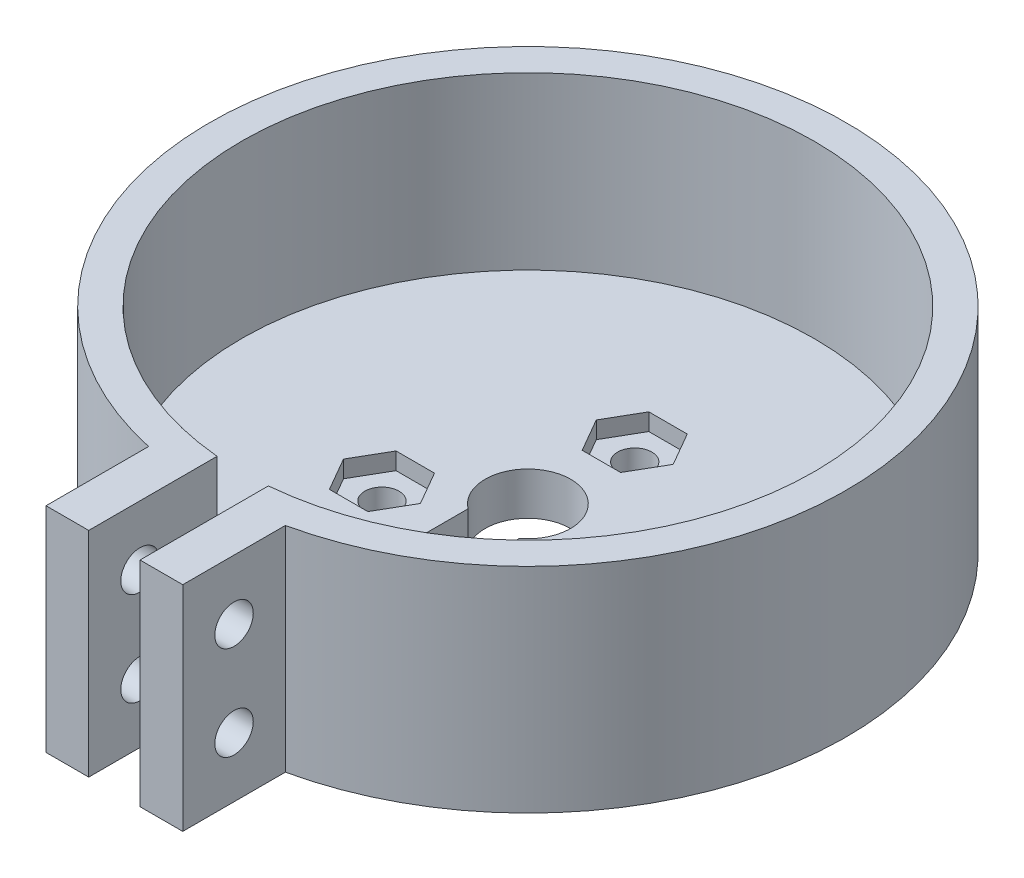
from build123d import *

# Parameters (mm, degrees)
SKETCH_1_R            = 37.25
SKETCH_1_R_2          = 33.5
MAIN_DEPTH            = 25
SKETCH_3_R            = 33.5
SKETCH_3_R_2          = 5
STOP_DEPTH            = 5
LOCK_DEPTH            = 25
SKETCH_5_W            = 6
SKETCH_5_H            = 48.380798507
SLOT_DEPTH            = 25
SKETCH_6_R            = 2.25
SMALL_HOLES_DEPTH     = 71.804407802
HOLES_FOR_BOLTS_REACH = 66.252
SKETCH_7_R            = 2
HEXAGONS_DEPTH        = 2


with BuildPart() as part:
    # Эскиз1 → main (new body)
    with BuildSketch(Plane(origin=(0, 0, 0), x_dir=(1, 0, 0), z_dir=(0, 1, 0))):
        with Locations(Location((0, 0, 0), (0, 0, 90))):
            Circle(SKETCH_1_R)
        with Locations(Location((0, 0, 0), (0, 0, 270))):
            Circle(SKETCH_1_R_2, mode=Mode.SUBTRACT)
    extrude(amount=MAIN_DEPTH)

    # Эскиз3 → stop (add)
    with BuildSketch(Plane(origin=(0, 0, 0), x_dir=(1, 0, 0), z_dir=(0, 1, 0))):
        with Locations(Location((0, 0, 0), (0, 0, 270))):
            Circle(SKETCH_3_R)
        with Locations(Location((0, 0, 0), (0, 0, 270))):
            Circle(SKETCH_3_R_2, mode=Mode.SUBTRACT)
    extrude(amount=STOP_DEPTH)

    # Эскиз4 → lock (add)
    with BuildSketch(Plane(origin=(0, 0, 0), x_dir=(1, 0, 0), z_dir=(0, 1, 0))):
        with BuildLine():
            Line((-8, -36.380798507), (-8, -48.380798507))
            Line((-8, -48.380798507), (8, -48.380798507))
            Line((8, -48.380798507), (8, -36.380798507))
            ThreePointArc((8, -36.380798507), (0, -37.25), (-8, -36.380798507))
        make_face()
    extrude(amount=LOCK_DEPTH)

    # Эскиз5 → slot (cut)
    with BuildSketch(Plane(origin=(0, 0, 0), x_dir=(1, 0, 0), z_dir=(0, 1, 0))):
        with Locations((0, -24.190399254)):
            Rectangle(SKETCH_5_W, SKETCH_5_H)
    extrude(amount=SLOT_DEPTH, mode=Mode.SUBTRACT)

    # Эскиз6 → small holes (cut, through all)
    with BuildSketch(Plane(origin=(8, 0, 0), x_dir=(0, 0, -1), z_dir=(1, 0, 0))):
        with Locations((-42.380798507, 7)):
            Circle(SKETCH_6_R)
        with Locations((-42.380798507, 18)):
            Circle(SKETCH_6_R)
    extrude(amount=-SMALL_HOLES_DEPTH, mode=Mode.SUBTRACT)

    # Эскиз7 → holes for bolts (cut, up to next)
    with BuildSketch(Plane(origin=(0, 5, 0), x_dir=(1, 0, 0), z_dir=(0, 1, 0)), mode=Mode.PRIVATE) as holes_for_bolts_sk1:
        with Locations(Location((0, 12.5, 0), (0, 0, 270))):
            Circle(SKETCH_7_R)
    holes_for_bolts_tool1 = extrude(holes_for_bolts_sk1.sketch, amount=-HOLES_FOR_BOLTS_REACH, mode=Mode.PRIVATE) & part.part
    # Эскиз7 → holes for bolts (cut, up to next)
    with BuildSketch(Plane(origin=(0, 5, 0), x_dir=(1, 0, 0), z_dir=(0, 1, 0)), mode=Mode.PRIVATE) as holes_for_bolts_sk2:
        with Locations(Location((-10.825317547, -6.25, 0), (0, 0, 270))):
            Circle(SKETCH_7_R)
    holes_for_bolts_tool2 = extrude(holes_for_bolts_sk2.sketch, amount=-HOLES_FOR_BOLTS_REACH, mode=Mode.PRIVATE) & part.part
    # Эскиз7 → holes for bolts (cut, up to next)
    with BuildSketch(Plane(origin=(0, 5, 0), x_dir=(1, 0, 0), z_dir=(0, 1, 0)), mode=Mode.PRIVATE) as holes_for_bolts_sk3:
        with Locations(Location((10.825317547, -6.25, 0), (0, 0, 90))):
            Circle(SKETCH_7_R)
    holes_for_bolts_tool3 = extrude(holes_for_bolts_sk3.sketch, amount=-HOLES_FOR_BOLTS_REACH, mode=Mode.PRIVATE) & part.part
    add(holes_for_bolts_tool1.solids().sort_by_distance((0, 5, -12.5))[0], mode=Mode.SUBTRACT)
    add(holes_for_bolts_tool2.solids().sort_by_distance((-10.825318, 5, 6.25))[0], mode=Mode.SUBTRACT)
    add(holes_for_bolts_tool3.solids().sort_by_distance((10.825318, 5, 6.25))[0], mode=Mode.SUBTRACT)

    # Эскиз8 → hexagons (cut)
    with BuildSketch(Plane(origin=(0, 5, 0), x_dir=(1, 0, 0), z_dir=(0, 1, 0))):
        Polygon((-8.575317547, -10.147114317), (-6.325317547, -6.25), (-8.575317547, -2.352885683), (-13.075317547, -2.352885683), (-15.325317547, -6.25), (-13.075317547, -10.147114317), align=None)
        Polygon((13.075317547, -10.147114317), (15.325317547, -6.25), (13.075317547, -2.352885683), (8.575317547, -2.352885683), (6.325317547, -6.25), (8.575317547, -10.147114317), align=None)
        Polygon((2.25, 8.602885683), (4.5, 12.5), (2.25, 16.397114317), (-2.25, 16.397114317), (-4.5, 12.5), (-2.25, 8.602885683), align=None)
    extrude(amount=-HEXAGONS_DEPTH, mode=Mode.SUBTRACT)


solid = part.part
